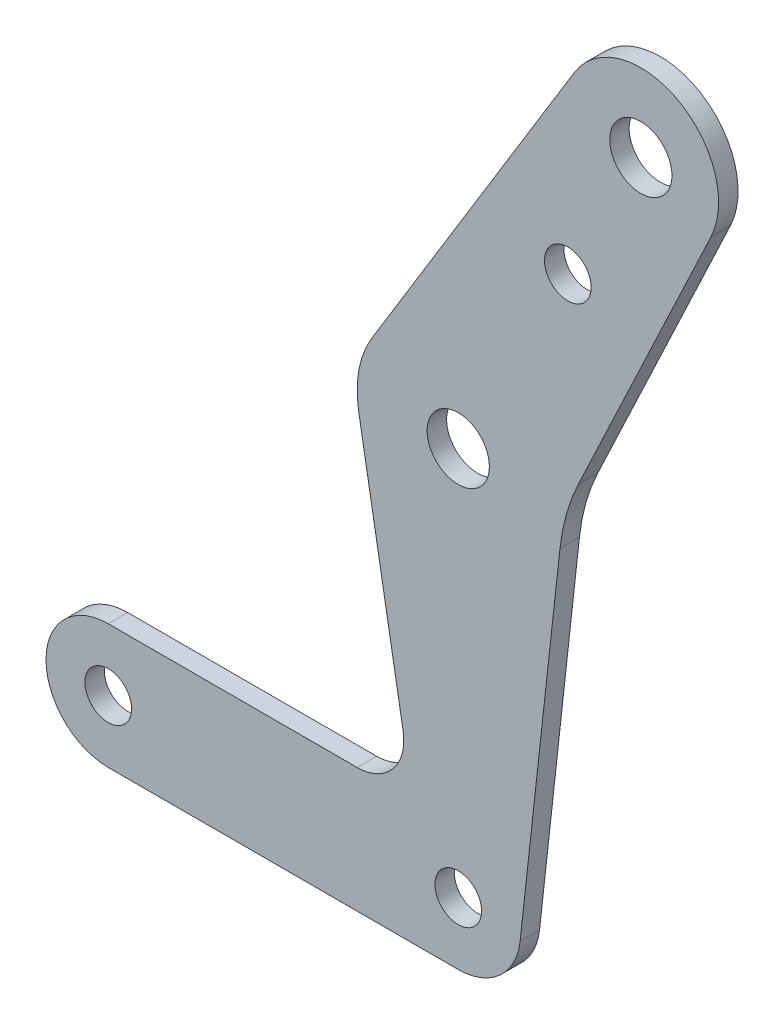
from build123d import *

# Parameters (mm, degrees)
SKETCH1_R           = 3
SKETCH1_R_2         = 4
BOSS_EXTRUDE1_DEPTH = 2.5


with BuildPart() as part:
    # Sketch1 → Boss-Extrude1 (new body)
    with BuildSketch(Plane.XY):
        with BuildLine():
            Line((0, 8), (32, 8))
            ThreePointArc((32, 8), (36.593139272, 10.139550333), (37.910527657, 15.032309457))
            Line((37.910527657, 15.032309457), (32.193856743, 47.763329509))
            ThreePointArc((32.193856743, 47.763329509), (32.22883707, 52.428455766), (33.908548714, 56.780833899))
            Line((33.908548714, 56.780833899), (59.941692535, 99.363405719))
            ThreePointArc((59.941692535, 99.363405719), (73.225386921, 102.946261009), (77.514221445, 89.873415603))
            Line((77.514221445, 89.873415603), (60.418365287, 53.710842379))
            ThreePointArc((60.418365287, 53.710842379), (58.907618727, 49.682233543), (58.081938825, 45.459639907))
            Line((58.081938825, 45.459639907), (52.951415095, -0.880339702))
            ThreePointArc((52.951415095, -0.880339702), (50.336538316, -5.959979766), (45, -8))
            Line((45, -8), (0, -8))
            ThreePointArc((0, -8), (-8, 0), (0, 8))
        make_face()
        Circle(SKETCH1_R, mode=Mode.SUBTRACT)
        with Locations((45, 0)):
            Circle(SKETCH1_R, mode=Mode.SUBTRACT)
        with Locations((45, 50)):
            Circle(SKETCH1_R_2, mode=Mode.SUBTRACT)
        with Locations((59.084146884, 76.488427786)):
            Circle(SKETCH1_R, mode=Mode.SUBTRACT)
        with Locations((68.473578139, 94.147379643)):
            Circle(SKETCH1_R_2, mode=Mode.SUBTRACT)
    extrude(amount=BOSS_EXTRUDE1_DEPTH)


solid = part.part
